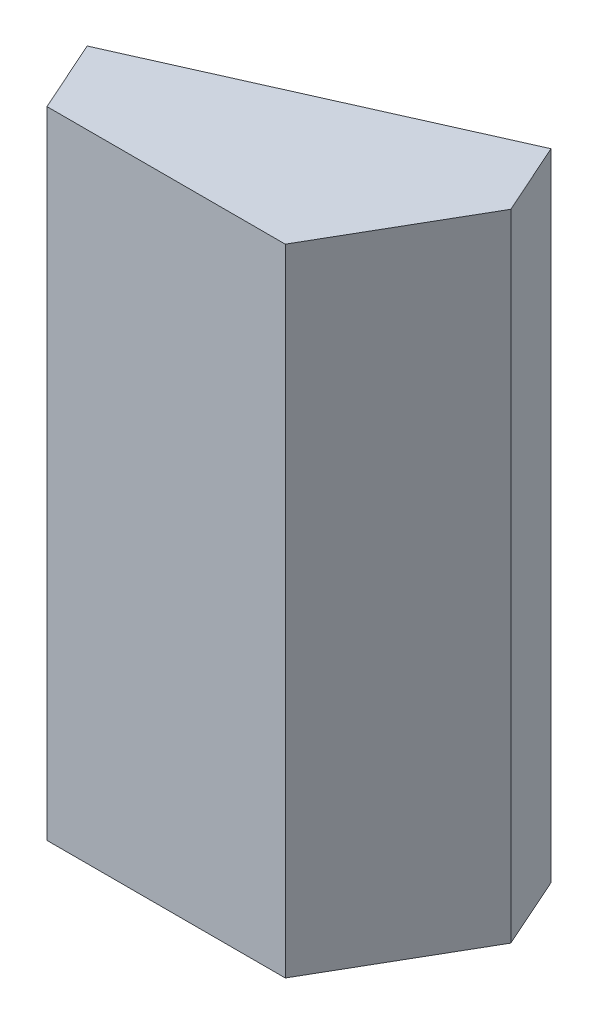
from build123d import *

# Parameters (mm, degrees)
BOSS_EXTRUDE1_DEPTH = 50.8


with BuildPart() as part:
    # Sketch1 → Boss-Extrude1 (new body)
    with BuildSketch(Plane(origin=(0, 0, 0), x_dir=(1, 0, 0), z_dir=(0, 1, 0))):
        Polygon((-19.05, 0), (0, 0), (6.599113577, 11.43), (4.014396166, 17.230149645), (-21.634717411, 5.800149645), align=None)
    extrude(amount=BOSS_EXTRUDE1_DEPTH)


solid = part.part
